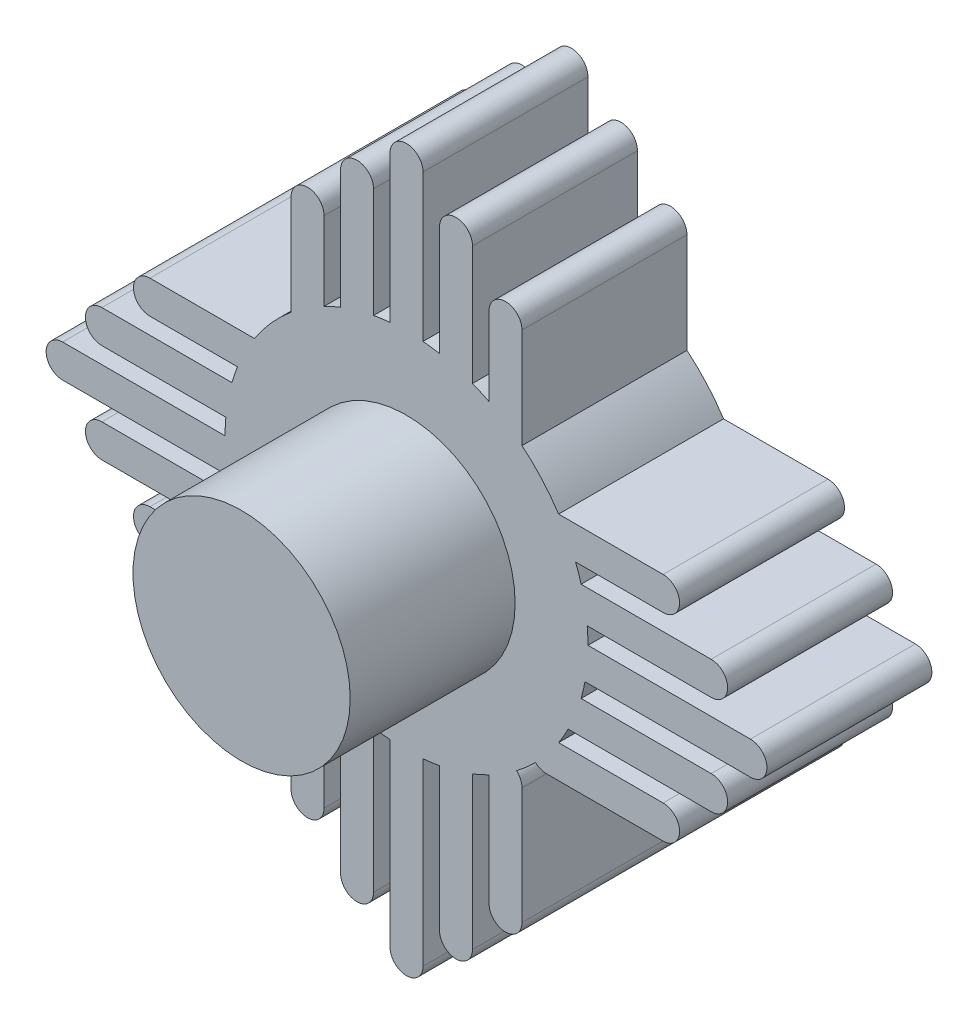
from build123d import *

# Parameters (mm, degrees)
BOSS_EXTRUDE3_DEPTH    = 10
BOSS_EXTRUDE3_2_DEPTH  = 10
BOSS_EXTRUDE3_3_DEPTH  = 10
BOSS_EXTRUDE3_4_DEPTH  = 10
BOSS_EXTRUDE3_5_DEPTH  = 10
BOSS_EXTRUDE3_6_DEPTH  = 10
BOSS_EXTRUDE3_7_DEPTH  = 10
BOSS_EXTRUDE3_8_DEPTH  = 10
BOSS_EXTRUDE3_9_DEPTH  = 10
BOSS_EXTRUDE3_10_DEPTH = 10
BOSS_EXTRUDE3_11_DEPTH = 10
BOSS_EXTRUDE3_12_DEPTH = 10
BOSS_EXTRUDE3_13_DEPTH = 10
BOSS_EXTRUDE3_14_DEPTH = 10
BOSS_EXTRUDE3_15_DEPTH = 10
BOSS_EXTRUDE3_16_DEPTH = 10
BOSS_EXTRUDE3_17_DEPTH = 10
BOSS_EXTRUDE3_18_DEPTH = 10
BOSS_EXTRUDE3_19_DEPTH = 10
BOSS_EXTRUDE3_20_DEPTH = 10
SKETCH12_R             = 11
BOSS_EXTRUDE4_DEPTH    = 10
SKETCH13_R             = 6.585
BOSS_EXTRUDE5_DEPTH    = 10


with BuildPart() as part:
    # Sketch11 → Boss-Extrude3 (new body)
    with BuildSketch(Plane.XY):
        with BuildLine():
            Line((24.4, 31.507143862), (24.4, 46.249205315))
            ThreePointArc((24.4, 46.249205315), (25.4, 47.249205315), (26.4, 46.249205315))
            Line((26.4, 46.249205315), (26.4, 31.507143862))
            ThreePointArc((26.4, 31.507143862), (25.4, 30.507143862), (24.4, 31.507143862))
        make_face()
    extrude(amount=BOSS_EXTRUDE3_DEPTH)



with BuildPart() as body_2:
    # Sketch11 → Boss-Extrude3 2 (new body)
    with BuildSketch(Plane.XY):
        with BuildLine():
            Line((27.4, 30.400840206), (27.4, 43.867696771))
            ThreePointArc((27.4, 43.867696771), (28.4, 44.867696771), (29.4, 43.867696771))
            Line((29.4, 43.867696771), (29.4, 30.400840206))
            ThreePointArc((29.4, 30.400840206), (28.4, 29.400840206), (27.4, 30.400840206))
        make_face()
    extrude(amount=BOSS_EXTRUDE3_2_DEPTH)


with BuildPart() as body_3:
    # Sketch11 → Boss-Extrude3 3 (new body)
    with BuildSketch(Plane.XY):
        with BuildLine():
            Line((30.4, 33.885281374), (30.4, 40.954829552))
            ThreePointArc((30.4, 40.954829552), (31.4, 41.954829552), (32.4, 40.954829552))
            Line((32.4, 40.954829552), (32.4, 33.885281374))
            ThreePointArc((32.4, 33.885281374), (31.4, 32.885281374), (30.4, 33.885281374))
        make_face()
    extrude(amount=BOSS_EXTRUDE3_3_DEPTH)


with BuildPart() as body_4:
    # Sketch11 → Boss-Extrude3 4 (new body)
    with BuildSketch(Plane.XY):
        with BuildLine():
            Line((23.4, 30.400840206), (23.4, 43.867696771))
            ThreePointArc((23.4, 43.867696771), (22.4, 44.867696771), (21.4, 43.867696771))
            Line((21.4, 43.867696771), (21.4, 30.400840206))
            ThreePointArc((21.4, 30.400840206), (22.4, 29.400840206), (23.4, 30.400840206))
        make_face()
    extrude(amount=BOSS_EXTRUDE3_4_DEPTH)


with BuildPart() as body_5:
    # Sketch11 → Boss-Extrude3 5 (new body)
    with BuildSketch(Plane.XY):
        with BuildLine():
            Line((20.4, 33.885281374), (20.4, 40.954829552))
            ThreePointArc((20.4, 40.954829552), (19.4, 41.954829552), (18.4, 40.954829552))
            Line((18.4, 40.954829552), (18.4, 33.885281374))
            ThreePointArc((18.4, 33.885281374), (19.4, 32.885281374), (20.4, 33.885281374))
        make_face()
    extrude(amount=BOSS_EXTRUDE3_5_DEPTH)


with BuildPart() as body_6:
    # Sketch11 → Boss-Extrude3 6 (new body)
    with BuildSketch(Plane.XY):
        with BuildLine():
            Line((31.507143862, 26.4), (46.249205315, 26.4))
            ThreePointArc((46.249205315, 26.4), (47.249205315, 25.4), (46.249205315, 24.4))
            Line((46.249205315, 24.4), (31.507143862, 24.4))
            ThreePointArc((31.507143862, 24.4), (30.507143862, 25.4), (31.507143862, 26.4))
        make_face()
    extrude(amount=BOSS_EXTRUDE3_6_DEPTH)


with BuildPart() as body_7:
    # Sketch11 → Boss-Extrude3 7 (new body)
    with BuildSketch(Plane.XY):
        with BuildLine():
            Line((30.400840206, 23.4), (43.867696771, 23.4))
            ThreePointArc((43.867696771, 23.4), (44.867696771, 22.4), (43.867696771, 21.4))
            Line((43.867696771, 21.4), (30.400840206, 21.4))
            ThreePointArc((30.400840206, 21.4), (29.400840206, 22.4), (30.400840206, 23.4))
        make_face()
    extrude(amount=BOSS_EXTRUDE3_7_DEPTH)


with BuildPart() as body_8:
    # Sketch11 → Boss-Extrude3 8 (new body)
    with BuildSketch(Plane.XY):
        with BuildLine():
            Line((33.885281374, 20.4), (40.954829552, 20.4))
            ThreePointArc((40.954829552, 20.4), (41.954829552, 19.4), (40.954829552, 18.4))
            Line((40.954829552, 18.4), (33.885281374, 18.4))
            ThreePointArc((33.885281374, 18.4), (32.885281374, 19.4), (33.885281374, 20.4))
        make_face()
    extrude(amount=BOSS_EXTRUDE3_8_DEPTH)


with BuildPart() as body_9:
    # Sketch11 → Boss-Extrude3 9 (new body)
    with BuildSketch(Plane.XY):
        with BuildLine():
            Line((30.400840206, 27.4), (43.867696771, 27.4))
            ThreePointArc((43.867696771, 27.4), (44.867696771, 28.4), (43.867696771, 29.4))
            Line((43.867696771, 29.4), (30.400840206, 29.4))
            ThreePointArc((30.400840206, 29.4), (29.400840206, 28.4), (30.400840206, 27.4))
        make_face()
    extrude(amount=BOSS_EXTRUDE3_9_DEPTH)


with BuildPart() as body_10:
    # Sketch11 → Boss-Extrude3 10 (new body)
    with BuildSketch(Plane.XY):
        with BuildLine():
            Line((33.885281374, 30.4), (40.954829552, 30.4))
            ThreePointArc((40.954829552, 30.4), (41.954829552, 31.4), (40.954829552, 32.4))
            Line((40.954829552, 32.4), (33.885281374, 32.4))
            ThreePointArc((33.885281374, 32.4), (32.885281374, 31.4), (33.885281374, 30.4))
        make_face()
    extrude(amount=BOSS_EXTRUDE3_10_DEPTH)


with BuildPart() as body_11:
    # Sketch11 → Boss-Extrude3 11 (new body)
    with BuildSketch(Plane.XY):
        with BuildLine():
            Line((26.4, 19.292856138), (26.4, 4.550794685))
            ThreePointArc((26.4, 4.550794685), (25.4, 3.550794685), (24.4, 4.550794685))
            Line((24.4, 4.550794685), (24.4, 19.292856138))
            ThreePointArc((24.4, 19.292856138), (25.4, 20.292856138), (26.4, 19.292856138))
        make_face()
    extrude(amount=BOSS_EXTRUDE3_11_DEPTH)


with BuildPart() as body_12:
    # Sketch11 → Boss-Extrude3 12 (new body)
    with BuildSketch(Plane.XY):
        with BuildLine():
            Line((23.4, 20.399159794), (23.4, 6.932303229))
            ThreePointArc((23.4, 6.932303229), (22.4, 5.932303229), (21.4, 6.932303229))
            Line((21.4, 6.932303229), (21.4, 20.399159794))
            ThreePointArc((21.4, 20.399159794), (22.4, 21.399159794), (23.4, 20.399159794))
        make_face()
    extrude(amount=BOSS_EXTRUDE3_12_DEPTH)


with BuildPart() as body_13:
    # Sketch11 → Boss-Extrude3 13 (new body)
    with BuildSketch(Plane.XY):
        with BuildLine():
            Line((20.4, 16.914718626), (20.4, 9.845170448))
            ThreePointArc((20.4, 9.845170448), (19.4, 8.845170448), (18.4, 9.845170448))
            Line((18.4, 9.845170448), (18.4, 16.914718626))
            ThreePointArc((18.4, 16.914718626), (19.4, 17.914718626), (20.4, 16.914718626))
        make_face()
    extrude(amount=BOSS_EXTRUDE3_13_DEPTH)


with BuildPart() as body_14:
    # Sketch11 → Boss-Extrude3 14 (new body)
    with BuildSketch(Plane.XY):
        with BuildLine():
            Line((27.4, 20.399159794), (27.4, 6.932303229))
            ThreePointArc((27.4, 6.932303229), (28.4, 5.932303229), (29.4, 6.932303229))
            Line((29.4, 6.932303229), (29.4, 20.399159794))
            ThreePointArc((29.4, 20.399159794), (28.4, 21.399159794), (27.4, 20.399159794))
        make_face()
    extrude(amount=BOSS_EXTRUDE3_14_DEPTH)


with BuildPart() as body_15:
    # Sketch11 → Boss-Extrude3 15 (new body)
    with BuildSketch(Plane.XY):
        with BuildLine():
            Line((30.4, 16.914718626), (30.4, 9.845170448))
            ThreePointArc((30.4, 9.845170448), (31.4, 8.845170448), (32.4, 9.845170448))
            Line((32.4, 9.845170448), (32.4, 16.914718626))
            ThreePointArc((32.4, 16.914718626), (31.4, 17.914718626), (30.4, 16.914718626))
        make_face()
    extrude(amount=BOSS_EXTRUDE3_15_DEPTH)


with BuildPart() as body_16:
    # Sketch11 → Boss-Extrude3 16 (new body)
    with BuildSketch(Plane.XY):
        with BuildLine():
            Line((19.292856138, 24.4), (4.550794685, 24.4))
            ThreePointArc((4.550794685, 24.4), (3.550794685, 25.4), (4.550794685, 26.4))
            Line((4.550794685, 26.4), (19.292856138, 26.4))
            ThreePointArc((19.292856138, 26.4), (20.292856138, 25.4), (19.292856138, 24.4))
        make_face()
    extrude(amount=BOSS_EXTRUDE3_16_DEPTH)


with BuildPart() as body_17:
    # Sketch11 → Boss-Extrude3 17 (new body)
    with BuildSketch(Plane.XY):
        with BuildLine():
            Line((20.399159794, 27.4), (6.932303229, 27.4))
            ThreePointArc((6.932303229, 27.4), (5.932303229, 28.4), (6.932303229, 29.4))
            Line((6.932303229, 29.4), (20.399159794, 29.4))
            ThreePointArc((20.399159794, 29.4), (21.399159794, 28.4), (20.399159794, 27.4))
        make_face()
    extrude(amount=BOSS_EXTRUDE3_17_DEPTH)


with BuildPart() as body_18:
    # Sketch11 → Boss-Extrude3 18 (new body)
    with BuildSketch(Plane.XY):
        with BuildLine():
            Line((16.914718626, 30.4), (9.845170448, 30.4))
            ThreePointArc((9.845170448, 30.4), (8.845170448, 31.4), (9.845170448, 32.4))
            Line((9.845170448, 32.4), (16.914718626, 32.4))
            ThreePointArc((16.914718626, 32.4), (17.914718626, 31.4), (16.914718626, 30.4))
        make_face()
    extrude(amount=BOSS_EXTRUDE3_18_DEPTH)


with BuildPart() as body_19:
    # Sketch11 → Boss-Extrude3 19 (new body)
    with BuildSketch(Plane.XY):
        with BuildLine():
            Line((20.399159794, 23.4), (6.932303229, 23.4))
            ThreePointArc((6.932303229, 23.4), (5.932303229, 22.4), (6.932303229, 21.4))
            Line((6.932303229, 21.4), (20.399159794, 21.4))
            ThreePointArc((20.399159794, 21.4), (21.399159794, 22.4), (20.399159794, 23.4))
        make_face()
    extrude(amount=BOSS_EXTRUDE3_19_DEPTH)


with BuildPart() as body_20:
    # Sketch11 → Boss-Extrude3 20 (new body)
    with BuildSketch(Plane.XY):
        with BuildLine():
            Line((16.914718626, 20.4), (9.845170448, 20.4))
            ThreePointArc((9.845170448, 20.4), (8.845170448, 19.4), (9.845170448, 18.4))
            Line((9.845170448, 18.4), (16.914718626, 18.4))
            ThreePointArc((16.914718626, 18.4), (17.914718626, 19.4), (16.914718626, 20.4))
        make_face()
    extrude(amount=BOSS_EXTRUDE3_20_DEPTH)


with BuildPart() as part_1:
    add(part.part)

    add(body_2.part)  # Boss-Extrude4 merges body 2

    add(body_3.part)  # Boss-Extrude4 merges body 3

    add(body_4.part)  # Boss-Extrude4 merges body 4

    add(body_5.part)  # Boss-Extrude4 merges body 5

    add(body_6.part)  # Boss-Extrude4 merges body 6

    add(body_7.part)  # Boss-Extrude4 merges body 7

    add(body_8.part)  # Boss-Extrude4 merges body 8

    add(body_9.part)  # Boss-Extrude4 merges body 9

    add(body_10.part)  # Boss-Extrude4 merges body 10

    add(body_11.part)  # Boss-Extrude4 merges body 11

    add(body_12.part)  # Boss-Extrude4 merges body 12

    add(body_13.part)  # Boss-Extrude4 merges body 13

    add(body_14.part)  # Boss-Extrude4 merges body 14

    add(body_15.part)  # Boss-Extrude4 merges body 15

    add(body_16.part)  # Boss-Extrude4 merges body 16

    add(body_17.part)  # Boss-Extrude4 merges body 17

    add(body_18.part)  # Boss-Extrude4 merges body 18

    add(body_19.part)  # Boss-Extrude4 merges body 19

    add(body_20.part)  # Boss-Extrude4 merges body 20
    # Sketch12 → Boss-Extrude4 (add)
    with BuildSketch(Plane.XY):
        with Locations((25.4, 26.4)):
            Circle(SKETCH12_R)
    extrude(amount=BOSS_EXTRUDE4_DEPTH)

    # Sketch13 → Boss-Extrude5 (add)
    with BuildSketch(Plane.XY.offset(10)):
        with Locations((25.4, 26.4)):
            Circle(SKETCH13_R)
    extrude(amount=BOSS_EXTRUDE5_DEPTH)


solid = part_1.part
